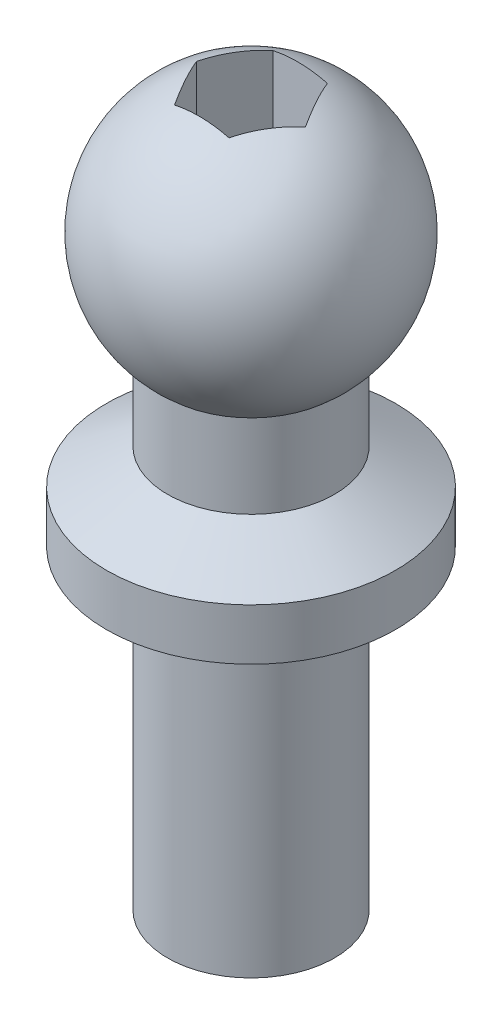
from build123d import *

# Parameters (mm, degrees)
TAGLIO_ESTRUSIONE1_DEPTH = 1.5


with BuildPart() as part:
    # Schizzo1 → Rivoluzione1 (revolve)
    with BuildSketch(Plane.XY, mode=Mode.PRIVATE) as rivoluzione1_sk:
        with BuildLine():
            Line((0, 0), (1.3, 0))
            Line((1.3, 0), (1.3, 4.9))
            Line((1.3, 4.9), (2.25, 4.9))
            Line((2.25, 4.9), (2.25, 5.7))
            Line((2.25, 5.7), (1.3, 6.248482756))
            Line((1.3, 6.248482756), (1.3, 7.548482756))
            ThreePointArc((1.3, 7.548482756), (1.930275607, 9.823885434), (0, 11.183569504))
            Line((0, 11.183569504), (0, 0))
        make_face()
    revolve(rivoluzione1_sk.sketch.rotate(Axis((0, 0, 0), (0, 1, 0)), 90), axis=Axis((0, 0, 0), (0, 1, 0)))

    # TaglioSuperficie1
    split(bisect_by=Plane(origin=(0, 11.09, 0), x_dir=(-1, 0, 0), z_dir=(0, -1, 0)), keep=Keep.TOP)

    # Schizzo2 → Taglio-Estrusione1 (cut)
    with BuildSketch(Plane(origin=(0, 11.09, 0), x_dir=(-1, 0, 0), z_dir=(0, -1, 0))):
        Polygon((-0.416334141, -0.759385201), (0.449479805, -0.740248543), (0.865813946, 0.019136658), (0.416334141, 0.759385201), (-0.449479805, 0.740248543), (-0.865813946, -0.019136658), align=None)
    extrude(amount=TAGLIO_ESTRUSIONE1_DEPTH, mode=Mode.SUBTRACT)


solid = part.part
